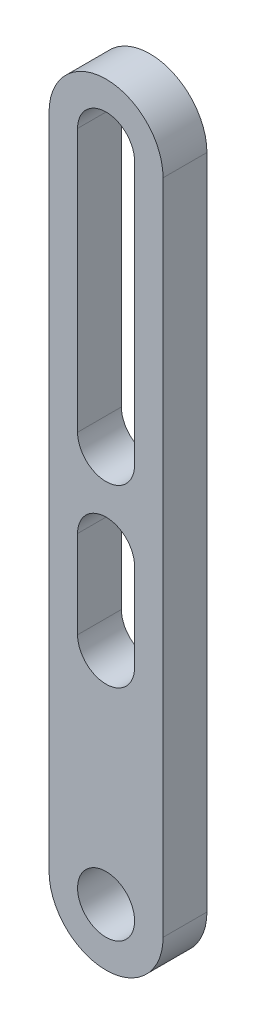
from build123d import *

# Parameters (mm, degrees)
SKETCH1_R           = 3.25
BOSS_EXTRUDE1_DEPTH = 5


with BuildPart() as part:
    # Sketch1 → Boss-Extrude1 (new body)
    with BuildSketch(Plane.XY):
        with BuildLine():
            Line((-6.5, 75), (-6.5, 0))
            ThreePointArc((-6.5, 0), (0, -6.5), (6.5, 0))
            Line((6.5, 0), (6.5, 75))
            ThreePointArc((6.5, 75), (0, 81.5), (-6.5, 75))
        make_face()
        Circle(SKETCH1_R, mode=Mode.SUBTRACT)
        with BuildLine():
            Line((-3.25, 75), (-3.25, 45))
            ThreePointArc((-3.25, 45), (0, 41.75), (3.25, 45))
            Line((3.25, 45), (3.25, 75))
            ThreePointArc((3.25, 75), (0, 78.25), (-3.25, 75))
        make_face(mode=Mode.SUBTRACT)
        with BuildLine():
            Line((3.25, 35), (3.25, 25))
            ThreePointArc((3.25, 25), (0, 21.75), (-3.25, 25))
            Line((-3.25, 25), (-3.25, 35))
            ThreePointArc((-3.25, 35), (0, 38.25), (3.25, 35))
        make_face(mode=Mode.SUBTRACT)
    extrude(amount=BOSS_EXTRUDE1_DEPTH)


solid = part.part
